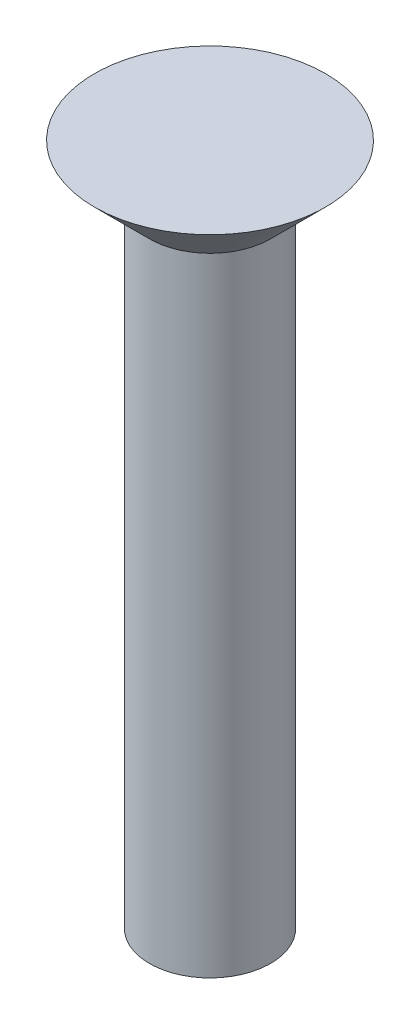
from build123d import *


with BuildPart() as part:
    # Sketch1 → Revolve1 (revolve)
    with BuildSketch(Plane.XY, mode=Mode.PRIVATE) as revolve1_sk:
        Polygon((0, -9.3), (0, 9.3), (3.15, 9.3), (1.65, 7.8), (1.65, -9.3), align=None)
    revolve(revolve1_sk.sketch.rotate(Axis((0, -9.3, 0), (0, 1, 0)), 90), axis=Axis((0, -9.3, 0), (0, 1, 0)))


solid = part.part
